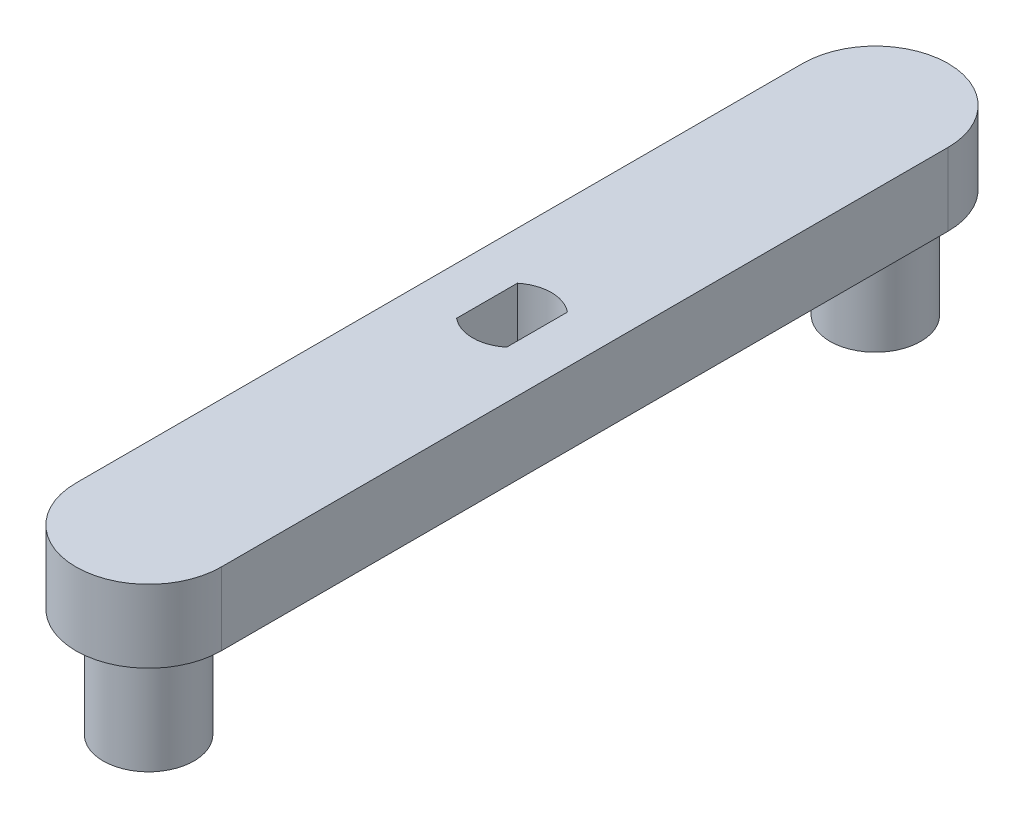
from build123d import *

# Parameters (mm, degrees)
BOSS_EXTRUDE1_DEPTH = 5.08
SKETCH3_R           = 3.175
BOSS_EXTRUDE2_DEPTH = 7.62
CUT_EXTRUDE1_REACH  = 35.408


with BuildPart() as part:
    # Sketch2 → Boss-Extrude1 (new body)
    with BuildSketch(Plane(origin=(0, 0, 0), x_dir=(1, 0, 0), z_dir=(0, 1, 0))):
        with BuildLine():
            Line((-5.08, 25.4), (-5.08, -25.4))
            ThreePointArc((-5.08, -25.4), (0, -30.48), (5.08, -25.4))
            Line((5.08, -25.4), (5.08, 25.4))
            ThreePointArc((5.08, 25.4), (0, 30.48), (-5.08, 25.4))
        make_face()
    extrude(amount=BOSS_EXTRUDE1_DEPTH)

    # Sketch3 → Boss-Extrude2 (add)
    with BuildSketch(Plane(origin=(0, 0, 0), x_dir=(-1, 0, 0), z_dir=(0, -1, 0))):
        with Locations(Location((0, -25.4, 0), (0, 0, 270))):
            Circle(SKETCH3_R)
        with Locations(Location((0, 25.4, 0), (0, 0, 270))):
            Circle(SKETCH3_R)
    extrude(amount=BOSS_EXTRUDE2_DEPTH)

    # Sketch10 → Cut-Extrude1 (cut, up to next)
    with BuildSketch(Plane(origin=(0, 5.08, 0), x_dir=(1, 0, 0), z_dir=(0, 1, 0)), mode=Mode.PRIVATE) as cut_extrude1_sk1:
        with BuildLine():
            Line((-1.75, 2.121320344), (-1.75, -2.121320344))
            ThreePointArc((-1.75, -2.121320344), (0, -2.75), (1.75, -2.121320344))
            Line((1.75, -2.121320344), (1.75, 2.121320344))
            ThreePointArc((1.75, 2.121320344), (0, 2.75), (-1.75, 2.121320344))
        make_face()
    cut_extrude1_tool1 = extrude(cut_extrude1_sk1.sketch, amount=-CUT_EXTRUDE1_REACH, mode=Mode.PRIVATE) & part.part
    add(cut_extrude1_tool1.solids().sort_by_distance((0, 5.08, 0))[0], mode=Mode.SUBTRACT)


solid = part.part
